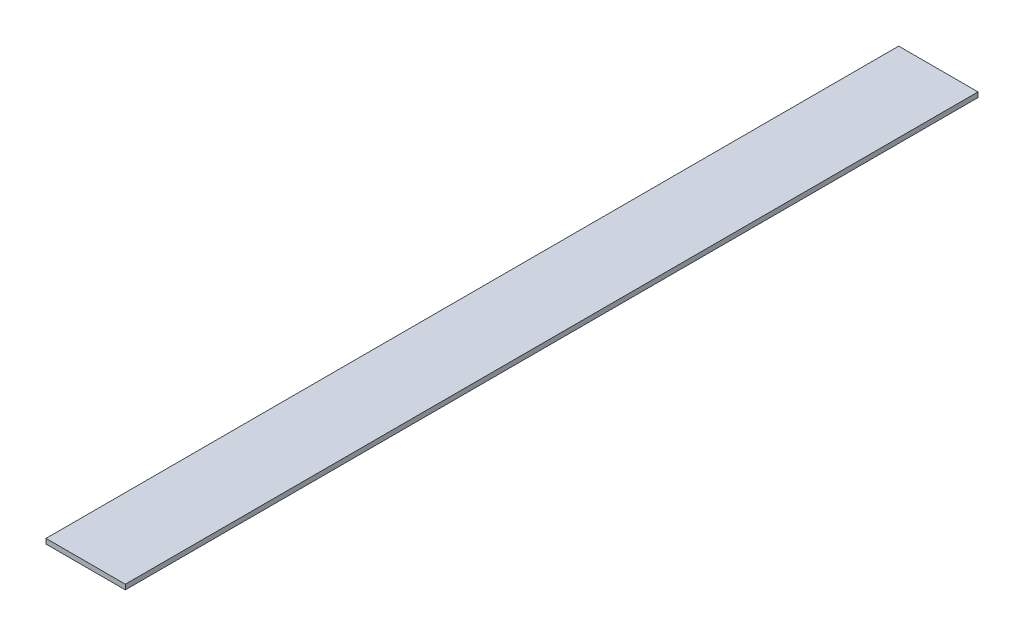
from build123d import *

# Parameters (mm, degrees)
SKETCH1_W           = 50.8
SKETCH1_H           = 546.1
BOSS_EXTRUDE1_DEPTH = 3.175


with BuildPart() as part:
    # Sketch1 → Boss-Extrude1 (new body)
    with BuildSketch(Plane(origin=(0, 0, 0), x_dir=(1, 0, 0), z_dir=(0, 1, 0))):
        with Locations((25.4, 273.05)):
            Rectangle(SKETCH1_W, SKETCH1_H)
    extrude(amount=BOSS_EXTRUDE1_DEPTH)


solid = part.part
